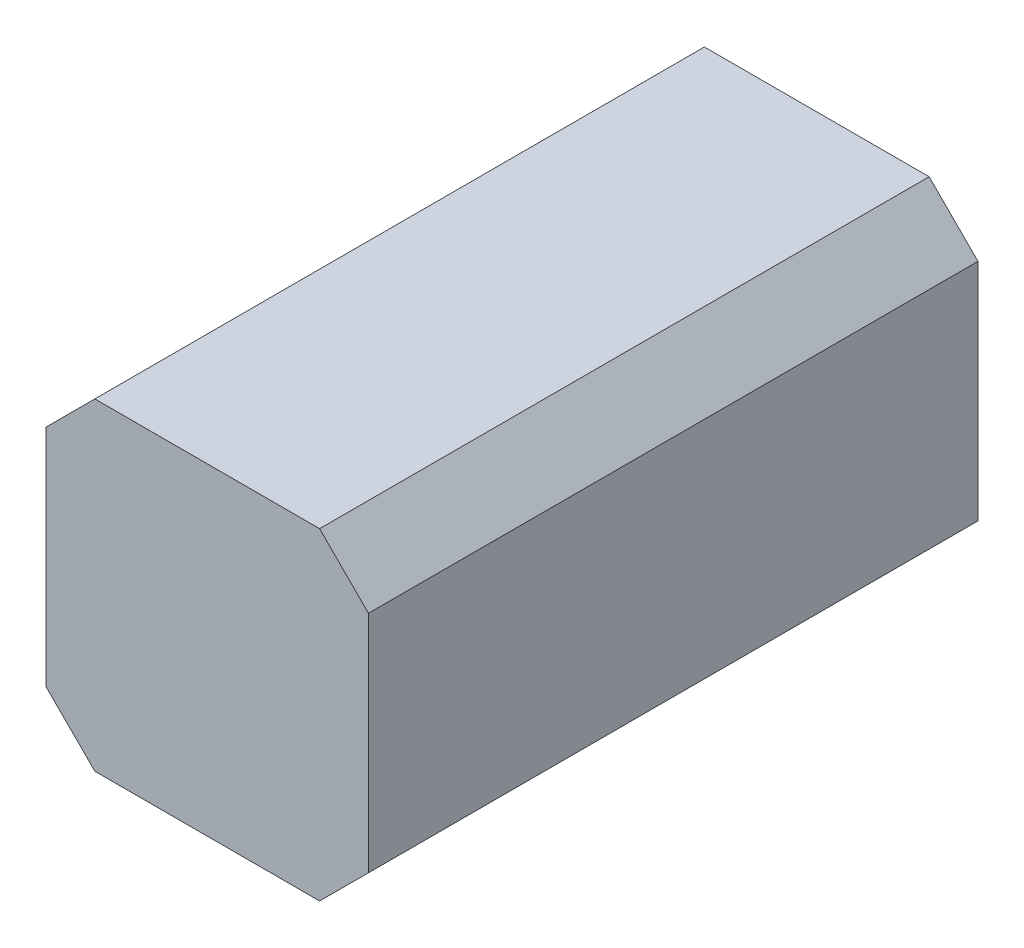
from build123d import *

# Parameters (mm, degrees)
EXTRUDE_2_DEPTH = 293
SCALE_3_SCALE   = 0.4


with BuildPart() as part:
    # 草图3 → 凸台-拉伸2 (new body)
    with BuildSketch(Plane.XY):
        Polygon((-77.5, -54.021861301), (-54.021861301, -77.5), (54.021861301, -77.5), (77.5, -54.021861301), (77.5, 54.021861301), (54.021861301, 77.5), (-54.021861301, 77.5), (-77.5, 54.021861301), align=None)
    extrude(amount=EXTRUDE_2_DEPTH)


with BuildPart() as part_1:
    # 缩放比例3: scaled about (0, 0, 0)
    add(part.part.scale(SCALE_3_SCALE))


solid = part_1.part
